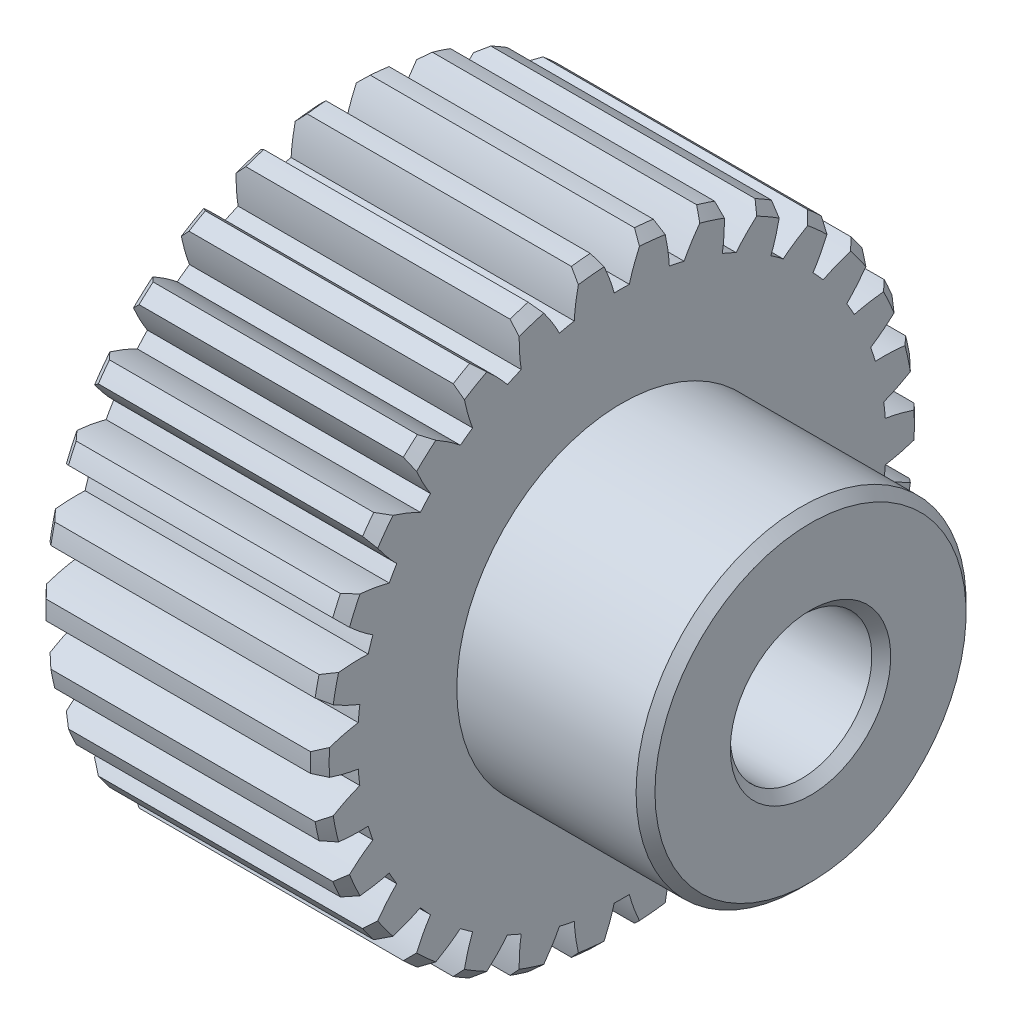
from build123d import *

# Parameters (mm, degrees)
CUT_EXTRUDE2_START = -16
CUT_EXTRUDE2_DEPTH = 16
CHAMFER1_SIZE      = 0.5
CIRPATTERN5_COUNT  = 30


with BuildPart() as part:
    # Sketch1 → Revolve1 (revolve)
    with BuildSketch(Plane.XY, mode=Mode.PRIVATE) as revolve1_sk:
        Polygon((-12.023818579, 16), (2.976181421, 16), (2.976181421, 8.741808754), (12.476181421, 8.741808754), (12.976181421, 8.241808754), (12.976181421, 4.25), (12.476181421, 3.75), (-11.523818579, 3.75), (-12.023818579, 4.25), align=None)
    revolve(revolve1_sk.sketch.rotate(Axis((-35.430185412, 0, 0), (1, 0, 0)), 90), axis=Axis((-35.430185412, 0, 0), (1, 0, 0)))

    # Sketch2 → Cut-Extrude2 (cut)
    with BuildSketch(Plane.ZY.offset(12.023818579).offset(CUT_EXTRUDE2_START)):
        with BuildLine():
            ThreePointArc((-0.4, 13.996079797), (0, 14.001794517), (0.4, 13.996079797))
            add(Edge.make_bspline(
                [(1.174377637, 15.956842957), (0.677707533, 15.019950225), (0.4, 13.996079797)],
                knots=[0, 0, 0, 1, 1, 1], degree=2))
            ThreePointArc((1.174377637, 15.956842957), (0, 16), (-1.174377637, 15.956842957))
            add(Edge.make_bspline(
                [(-1.174377637, 15.956842957), (-0.681964167, 15.018255657), (-0.4, 13.996079797)],
                knots=[0, 0, 0, 1, 1, 1], degree=2))
        make_face()
    cut_extrude2 = extrude(amount=CUT_EXTRUDE2_DEPTH, mode=Mode.SUBTRACT)

    # Chamfer1
    chamfer1_edges = [part.edges().sort_by_distance(p)[0] for p in [
        (2.976181421, -11.721562229, -10.890591302),
        (-12.023818579, -11.721562229, -10.890591302),
    ]]
    chamfer(chamfer1_edges, length=CHAMFER1_SIZE)

    # CirPattern5: Cut-Extrude2 ×30 about axis
    cirpattern5_axis = Axis((-11.523818579, 0, 0), (1, 0, 0))
    for i in range(1, CIRPATTERN5_COUNT):
        add(cut_extrude2.rotate(cirpattern5_axis, i * 360 / CIRPATTERN5_COUNT), mode=Mode.SUBTRACT)


solid = part.part
